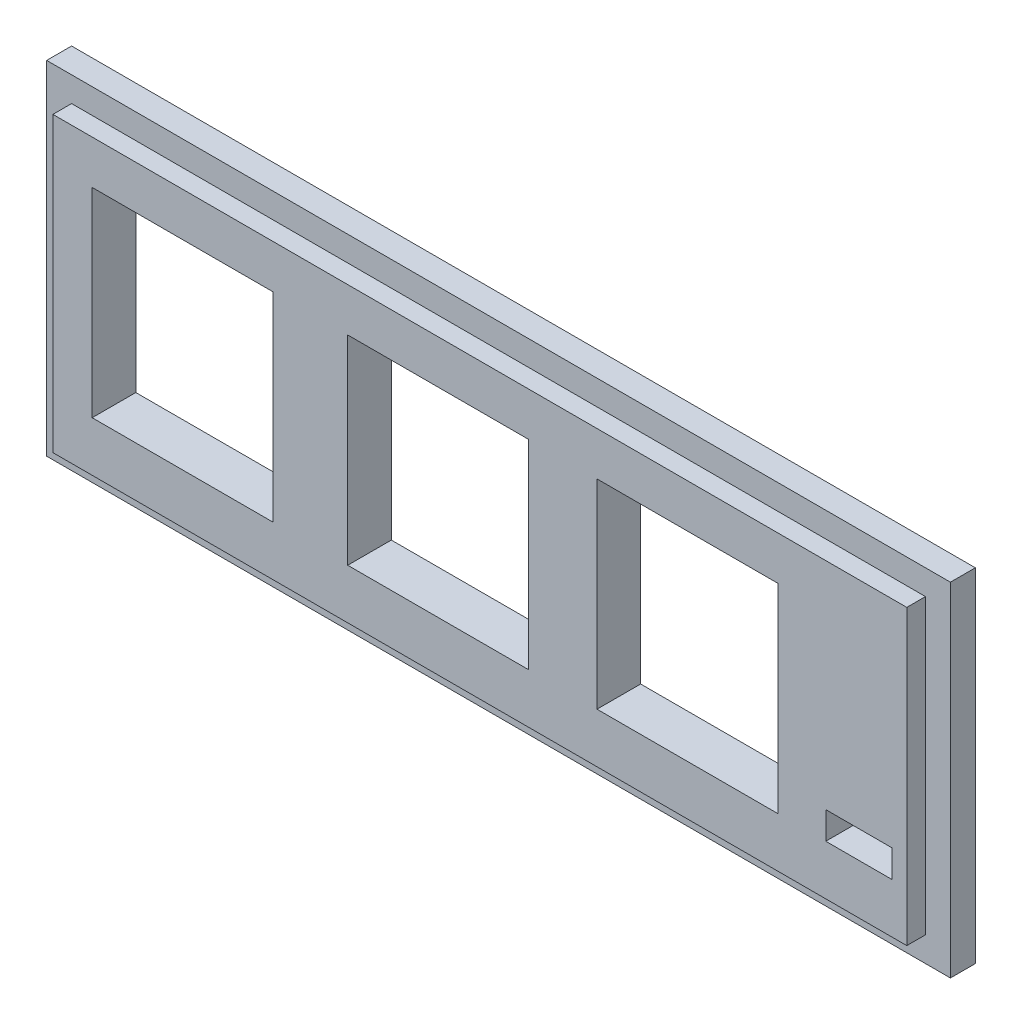
from build123d import *

# Parameters (mm, degrees)
SKICA1_W                 = 72.5
SKICA1_H                 = 27.5
P_IDAT_VYSUNUT_M1_DEPTH  = 2
SKICA2_W                 = 68.5
SKICA2_H                 = 23.5
P_IDAT_VYSUNUT_M2_DEPTH  = 1.5
SKICA3_W                 = 14.5
SKICA3_H                 = 16
SKICA3_W_2               = 5.3
SKICA3_H_2               = 2.2
ODEBRAT_VYSUNUT_M1_DEPTH = 39.927817817


with BuildPart() as part:
    # Skica1 → Přidat vysunutím1 (new body)
    with BuildSketch(Plane.XY):
        Rectangle(SKICA1_W, SKICA1_H)
    extrude(amount=P_IDAT_VYSUNUT_M1_DEPTH)

    # Skica2 → Přidat vysunutím2 (add)
    with BuildSketch(Plane.XY.offset(2)):
        Rectangle(SKICA2_W, SKICA2_H)
    extrude(amount=P_IDAT_VYSUNUT_M2_DEPTH)

    # Skica3 → Odebrat vysunutím1 (cut, through all)
    with BuildSketch(Plane.XY.offset(3.5)):
        with Locations((16.65, 0.25)):
            Rectangle(SKICA3_W, SKICA3_H)
        with Locations((-3.35, 0.25)):
            Rectangle(SKICA3_W, SKICA3_H)
        with Locations((-23.85, 0.25)):
            Rectangle(SKICA3_W, SKICA3_H)
        with Locations((30.4, -6.65)):
            Rectangle(SKICA3_W_2, SKICA3_H_2)
    extrude(amount=-ODEBRAT_VYSUNUT_M1_DEPTH, mode=Mode.SUBTRACT)


solid = part.part
